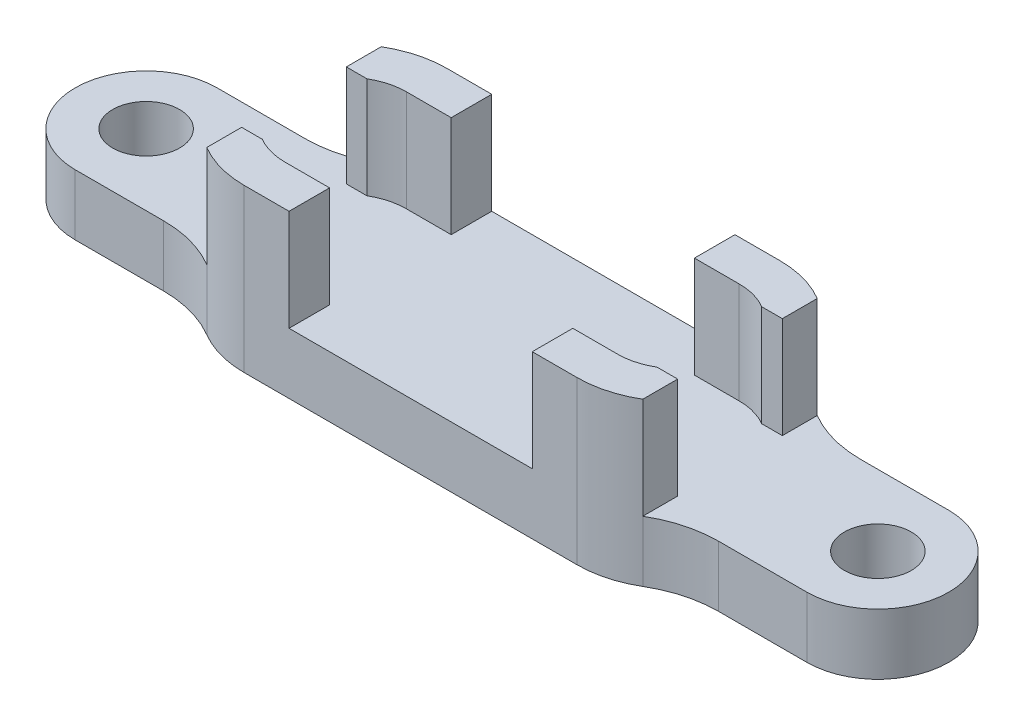
from build123d import *

# Parameters (mm, degrees)
SKETCH2_R           = 1.65
BOSS_EXTRUDE1_DEPTH = 3
BOSS_EXTRUDE2_DEPTH = 5


with BuildPart() as part:
    # Sketch2 → Boss-Extrude1 (new body)
    with BuildSketch(Plane(origin=(0, 0, 0), x_dir=(1, 0, 0), z_dir=(0, 1, 0))):
        with BuildLine():
            Line((0, 3.5), (4.356739527, 3.5))
            ThreePointArc((4.356739527, 3.5), (5.879286162, 3.704522124), (7.293887604, 4.303588328))
            ThreePointArc((7.293887604, 4.303588328), (8.519819988, 4.822755522), (9.839300635, 5))
            Line((9.839300635, 5), (26.260699365, 5))
            ThreePointArc((26.260699365, 5), (27.580180012, 4.822755522), (28.806112396, 4.303588328))
            ThreePointArc((28.806112396, 4.303588328), (30.220713838, 3.704522124), (31.743260473, 3.5))
            Line((31.743260473, 3.5), (36.1, 3.5))
            ThreePointArc((36.1, 3.5), (39.6, 0), (36.1, -3.5))
            Line((36.1, -3.5), (31.743260473, -3.5))
            ThreePointArc((31.743260473, -3.5), (30.220713838, -3.704522124), (28.806112396, -4.303588328))
            ThreePointArc((28.806112396, -4.303588328), (27.580180012, -4.822755522), (26.260699365, -5))
            Line((26.260699365, -5), (9.839300635, -5))
            ThreePointArc((9.839300635, -5), (8.519819988, -4.822755522), (7.293887604, -4.303588328))
            ThreePointArc((7.293887604, -4.303588328), (5.879286162, -3.704522124), (4.356739527, -3.5))
            Line((4.356739527, -3.5), (0, -3.5))
            ThreePointArc((0, -3.5), (-3.5, 0), (0, 3.5))
        make_face()
        with Locations(Location((0, 0, 0), (0, 0, 270))):
            Circle(SKETCH2_R, mode=Mode.SUBTRACT)
        with Locations(Location((36.1, 0, 0), (0, 0, 270))):
            Circle(SKETCH2_R, mode=Mode.SUBTRACT)
    extrude(amount=BOSS_EXTRUDE1_DEPTH)

    # Sketch3 → Boss-Extrude2 (add)
    with BuildSketch(Plane(origin=(0, 3, 0), x_dir=(1, 0, 0), z_dir=(0, 1, 0))):
        with BuildLine():
            Line((7.293887604, 4.303588328), (7.293887604, 2.582152997))
            Line((7.293887604, 2.582152997), (8.312052816, 2.582152997))
            ThreePointArc((8.312052816, 2.582152997), (9.047612247, 2.893653313), (9.839300635, 3))
            Line((9.839300635, 3), (12.05, 3))
            Line((12.05, 3), (12.05, 5))
            Line((12.05, 5), (9.839300635, 5))
            ThreePointArc((9.839300635, 5), (8.519819988, 4.822755522), (7.293887604, 4.303588328))
        make_face()
        with BuildLine():
            Line((28.806112396, 4.303588328), (28.806112396, 2.582152997))
            Line((28.806112396, 2.582152997), (27.787947184, 2.582152997))
            ThreePointArc((27.787947184, 2.582152997), (27.052387753, 2.893653313), (26.260699365, 3))
            Line((26.260699365, 3), (24.05, 3))
            Line((24.05, 3), (24.05, 5))
            Line((24.05, 5), (26.260699365, 5))
            ThreePointArc((26.260699365, 5), (27.580180012, 4.822755522), (28.806112396, 4.303588328))
        make_face()
        with BuildLine():
            Line((9.839300635, -3), (12.05, -3))
            Line((12.05, -3), (12.05, -5))
            Line((12.05, -5), (9.839300635, -5))
            ThreePointArc((9.839300635, -5), (8.519819988, -4.822755522), (7.293887604, -4.303588328))
            Line((7.293887604, -4.303588328), (7.293887604, -2.582152997))
            Line((7.293887604, -2.582152997), (8.312052816, -2.582152997))
            ThreePointArc((8.312052816, -2.582152997), (9.047612247, -2.893653313), (9.839300635, -3))
        make_face()
        with BuildLine():
            Line((27.787947184, -2.582152997), (28.806112396, -2.582152997))
            Line((28.806112396, -2.582152997), (28.806112396, -4.303588328))
            ThreePointArc((28.806112396, -4.303588328), (27.580180012, -4.822755522), (26.260699365, -5))
            Line((26.260699365, -5), (24.05, -5))
            Line((24.05, -5), (24.05, -3))
            Line((24.05, -3), (26.260699365, -3))
            ThreePointArc((26.260699365, -3), (27.052387753, -2.893653313), (27.787947184, -2.582152997))
        make_face()
    extrude(amount=BOSS_EXTRUDE2_DEPTH)


solid = part.part
